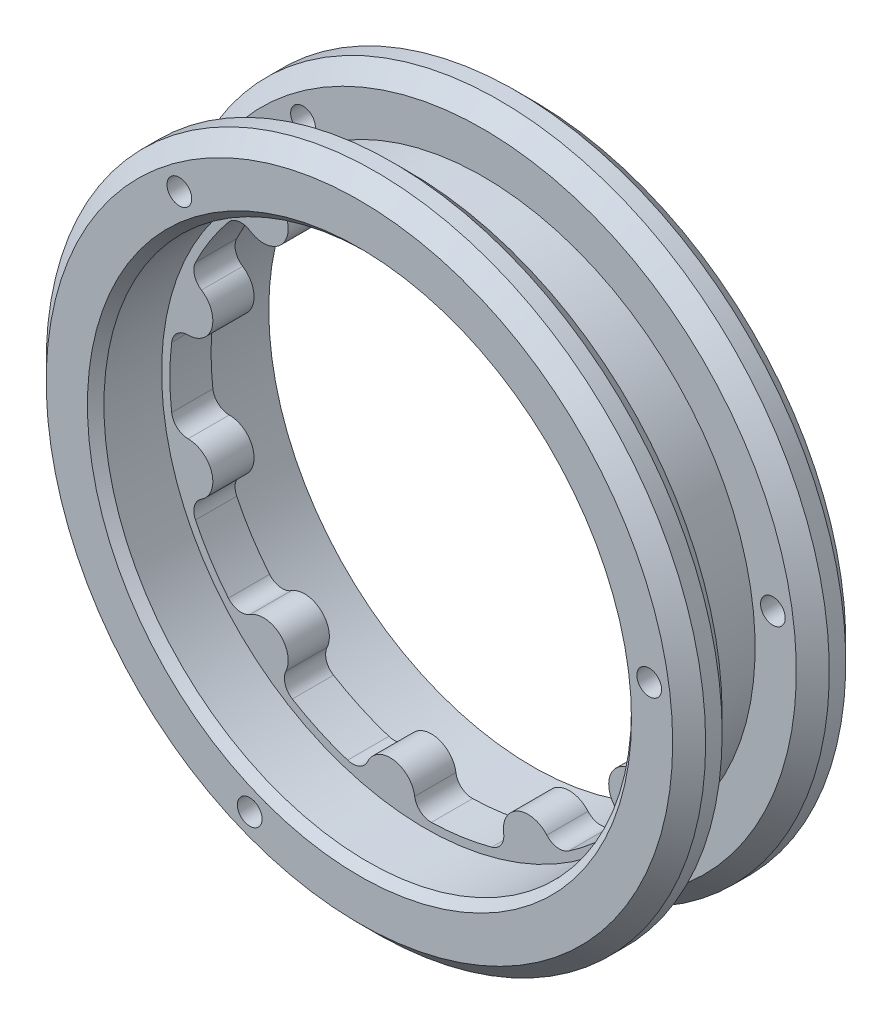
from build123d import *

# Parameters (mm, degrees)
SKETCH_1_R               = 16.5
EXTRUDE_1_DEPTH          = 6.5
EXTRUDE_START            = 4
SKETCH_2_R               = 16.5
SKETCH_2_R_2             = 16
EXTRUDE_2_DEPTH          = 4
CUT_EXTRUDE_START        = -4
SKETCH_4_R               = 16
CUT_EXTRUDE_2_DEPTH      = 4
SKETCH_5_R               = 20
SKETCH_5_R_2             = 16.5
EXTRUDE_3_DEPTH          = 3
EXTRUDE_START_2          = -3
SKETCH_6_R               = 20
SKETCH_6_R_2             = 16.5
EXTRUDE_4_DEPTH          = 3
CHAMFER_1_SIZE           = 1
SKETCH_7_R               = 0.75
CUT_EXTRUDE_3_DEPTH      = 33.445844482
PATTERN_CIRCULAR_1_COUNT = 3
CHAMFER_2_SIZE           = 0.5


with BuildPart() as part:
    # 草图1 → 凸台-拉伸1 (new body)
    with BuildSketch(Plane.XY.offset(13.616672725)):
        with Locations(Location((0.173765051, -3.140916746, 0), (0, 0, 180))):
            Circle(SKETCH_1_R)
        with BuildLine():
            ThreePointArc((-4.541092987, 11.624587434), (-6.265167651, 10.958379182), (-7.897683054, 10.091684113))
            ThreePointArc((-7.897683054, 10.091684113), (-8.333327501, 9.530083474), (-8.285825063, 8.820911505))
            ThreePointArc((-8.285825063, 8.820911505), (-8.666854858, 7.061702508), (-10.462383837, 6.934912591))
            ThreePointArc((-10.462383837, 6.934912591), (-11.157577156, 7.082857217), (-11.77546018, 6.731571106))
            ThreePointArc((-11.77546018, 6.731571106), (-12.865664708, 5.239015925), (-13.770453328, 3.627301174))
            ThreePointArc((-13.770453328, 3.627301174), (-13.833316529, 2.919325482), (-13.409947623, 2.348413815))
            ThreePointArc((-13.409947623, 2.348413815), (-12.779390093, 0.662472772), (-14.221337386, -0.414925949))
            ThreePointArc((-14.221337386, -0.414925949), (-14.886156125, -0.666316895), (-15.216032792, -1.295890359))
            ThreePointArc((-15.216032792, -1.295890359), (-15.326234949, -3.140916746), (-15.216032792, -4.985943132))
            ThreePointArc((-15.216032792, -4.985943132), (-14.886156125, -5.615516597), (-14.221337386, -5.866907543))
            ThreePointArc((-14.221337386, -5.866907543), (-12.779390093, -6.944306263), (-13.409947623, -8.630247307))
            ThreePointArc((-13.409947623, -8.630247307), (-13.833316529, -9.201158974), (-13.770453328, -9.909134666))
            ThreePointArc((-13.770453328, -9.909134666), (-12.865664708, -11.520849416), (-11.77546018, -13.013404598))
            ThreePointArc((-11.77546018, -13.013404598), (-11.157577156, -13.364690708), (-10.462383837, -13.216746083))
            ThreePointArc((-10.462383837, -13.216746083), (-8.666854858, -13.343536), (-8.285825063, -15.102744997))
            ThreePointArc((-8.285825063, -15.102744997), (-8.333327501, -15.811916965), (-7.897683054, -16.373517605))
            ThreePointArc((-7.897683054, -16.373517605), (-6.265167651, -17.240212674), (-4.541092987, -17.906420926))
            ThreePointArc((-4.541092987, -17.906420926), (-3.8313771, -17.867888824), (-3.326528168, -17.367580001))
            ThreePointArc((-3.326528168, -17.367580001), (-1.747485266, -16.503506211), (-0.475842415, -17.777446736))
            ThreePointArc((-0.475842415, -17.777446736), (-0.132396696, -18.399721916), (0.537714963, -18.636643268))
            ThreePointArc((0.537714963, -18.636643268), (2.379645044, -18.483149095), (4.19020832, -18.111494005))
            ThreePointArc((4.19020832, -18.111494005), (4.76642729, -17.695377361), (4.920645867, -17.001548857))
            ThreePointArc((4.920645867, -17.001548857), (5.781867726, -15.420948683), (7.540386014, -15.805153619))
            ThreePointArc((7.540386014, -15.805153619), (8.165738301, -16.142964039), (8.857561455, -15.979985248))
            ThreePointArc((8.857561455, -15.979985248), (10.324106427, -14.855035148), (11.646317267, -13.563514581))
            ThreePointArc((11.646317267, -13.563514581), (11.906093869, -12.901927489), (11.660718782, -12.234864952))
            ThreePointArc((11.660718782, -12.234864952), (11.530687744, -10.439567781), (13.217764337, -9.812054777))
            ThreePointArc((13.217764337, -9.812054777), (13.926478259, -9.758148014), (14.420363945, -9.247013695))
            ThreePointArc((14.420363945, -9.247013695), (15.045906142, -7.507771377), (15.459971947, -5.706433987))
            ThreePointArc((15.459971947, -5.706433987), (15.320828945, -5.009425675), (14.753765051, -4.580916746))
            ThreePointArc((14.753765051, -4.580916746), (13.673765051, -3.140916746), (14.753765051, -1.700916746))
            ThreePointArc((14.753765051, -1.700916746), (15.320828945, -1.272407817), (15.459971947, -0.575399504))
            ThreePointArc((15.459971947, -0.575399504), (15.045906142, 1.225937885), (14.420363945, 2.965180204))
            ThreePointArc((14.420363945, 2.965180204), (13.926478259, 3.476314523), (13.217764337, 3.530221285))
            ThreePointArc((13.217764337, 3.530221285), (11.530687744, 4.15773429), (11.660718782, 5.95303146))
            ThreePointArc((11.660718782, 5.95303146), (11.906093869, 6.620093998), (11.646317267, 7.281681089))
            ThreePointArc((11.646317267, 7.281681089), (10.324106427, 8.573201657), (8.857561455, 9.698151757))
            ThreePointArc((8.857561455, 9.698151757), (8.165738301, 9.861130547), (7.540386014, 9.523320128))
            ThreePointArc((7.540386014, 9.523320128), (5.781867726, 9.139115191), (4.920645867, 10.719715365))
            ThreePointArc((4.920645867, 10.719715365), (4.76642729, 11.413543869), (4.19020832, 11.829660513))
            ThreePointArc((4.19020832, 11.829660513), (2.379645044, 12.201315603), (0.537714963, 12.354809777))
            ThreePointArc((0.537714963, 12.354809777), (-0.132396696, 12.117888425), (-0.475842415, 11.495613244))
            ThreePointArc((-0.475842415, 11.495613244), (-1.747485266, 10.22167272), (-3.326528168, 11.08574651))
            ThreePointArc((-3.326528168, 11.08574651), (-3.8313771, 11.586055332), (-4.541092987, 11.624587434))
        make_face(mode=Mode.SUBTRACT)
    extrude(amount=EXTRUDE_1_DEPTH)

    # 草图2 → 凸台-拉伸2 (add)
    with BuildSketch(Plane(origin=(0, 0, 13.616672725), x_dir=(-1, 0, 0), z_dir=(0, 0, -1)).offset(EXTRUDE_START)):
        with Locations((-0.173765051, -3.140916746)):
            Circle(SKETCH_2_R)
        with Locations((-0.173765051, -3.140916746)):
            Circle(SKETCH_2_R_2, mode=Mode.SUBTRACT)
    extrude(amount=-EXTRUDE_2_DEPTH)

    # 草图4 → 切除-拉伸2 (cut)
    with BuildSketch(Plane.XY.offset(20.116672725).offset(CUT_EXTRUDE_START)):
        with Locations(Location((0.173765051, -3.140916746, 0), (0, 0, 180))):
            Circle(SKETCH_4_R)
    extrude(amount=CUT_EXTRUDE_2_DEPTH, mode=Mode.SUBTRACT)

    # 草图5 → 凸台-拉伸3 (add)
    with BuildSketch(Plane(origin=(0, 0, 9.616672725), x_dir=(-1, 0, 0), z_dir=(0, 0, -1))):
        with Locations((-0.173765051, -3.140916746)):
            Circle(SKETCH_5_R)
        with Locations((-0.173765051, -3.140916746)):
            Circle(SKETCH_5_R_2, mode=Mode.SUBTRACT)
    extrude(amount=-EXTRUDE_3_DEPTH)

    # 草图6 → 凸台-拉伸4 (add)
    with BuildSketch(Plane.XY.offset(20.116672725).offset(EXTRUDE_START_2)):
        with Locations(Location((0.173765051, -3.140916746, 0), (0, 0, 180))):
            Circle(SKETCH_6_R)
        with Locations(Location((0.173765051, -3.140916746, 0), (0, 0, 180))):
            Circle(SKETCH_6_R_2, mode=Mode.SUBTRACT)
    extrude(amount=EXTRUDE_4_DEPTH)

    # 倒角1
    chamfer_1_edges = [part.edges().sort_by_distance(p)[0] for p in [
        (20.173765051, -3.140916746, 12.616672725),
        (20.173765051, -3.140916746, 9.616672725),
        (20.173765051, -3.140916746, 17.116672725),
        (20.173765051, -3.140916746, 20.116672725),
    ]]
    chamfer(chamfer_1_edges, length=CHAMFER_1_SIZE)

    # 草图7 → 切除-拉伸3 (cut, through all)
    with BuildSketch(Plane.XY.offset(20.116672725)):
        with Locations((17.750861301, -0.675711568)):
            Circle(SKETCH_7_R)
    cut_extrude_3 = extrude(amount=-CUT_EXTRUDE_3_DEPTH, mode=Mode.SUBTRACT)

    # 阵列(圆周)1: 切除-拉伸3 ×3 about axis
    pattern_circular_1_axis = Axis((0.173765051, -3.140916746, 0), (0, 0, 1))
    for i in range(1, PATTERN_CIRCULAR_1_COUNT):
        add(cut_extrude_3.rotate(pattern_circular_1_axis, i * 360 / PATTERN_CIRCULAR_1_COUNT), mode=Mode.SUBTRACT)

    # 倒角2
    chamfer_2_edges = [part.edges().sort_by_distance(p)[0] for p in [
        (16.173765051, -3.140916746, 20.116672725),
    ]]
    chamfer(chamfer_2_edges, length=CHAMFER_2_SIZE)


solid = part.part
